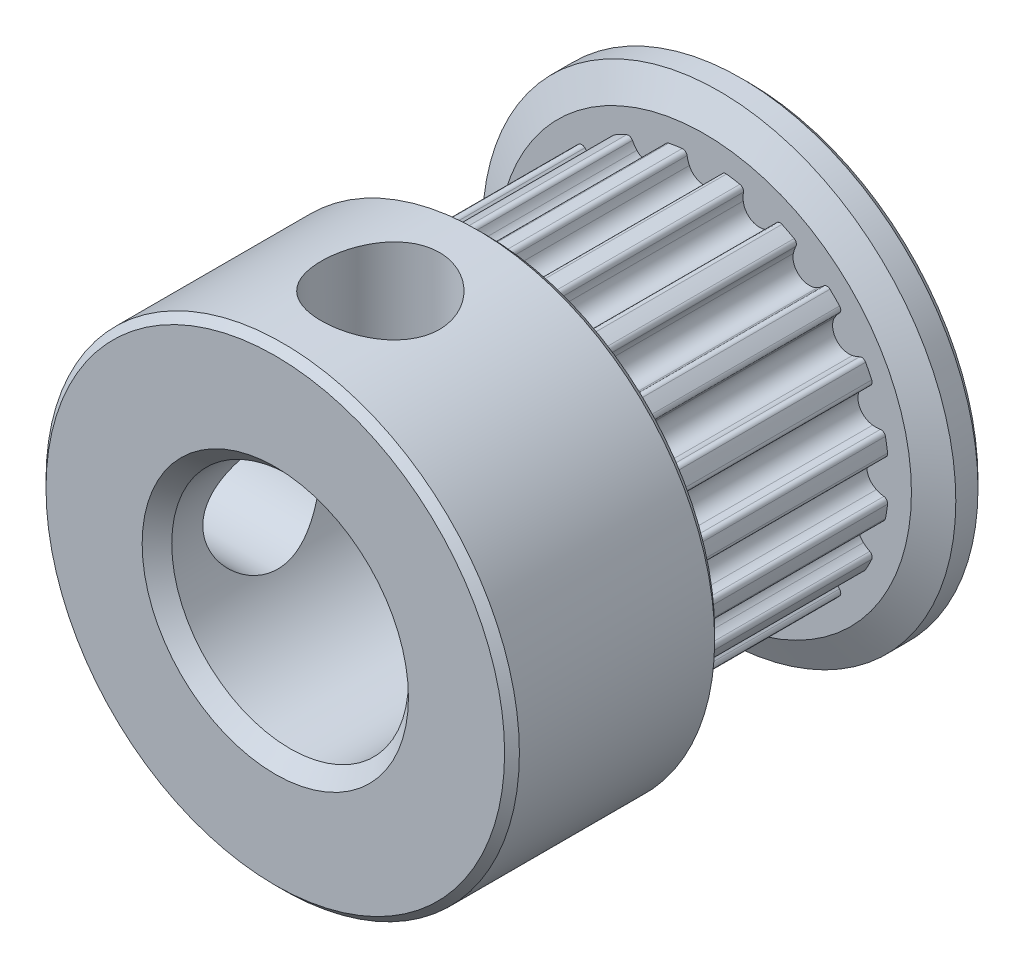
from build123d import *

# Parameters (mm, degrees)
SKETCH1_R            = 6.366
BASE_DEPTH           = 7.4
TOOTHCUT_DEPTH       = 12.653836793
TEETHCUTS_COUNT      = 20
SKETCH3_W            = 8
SKETCH3_H            = 7.1
SHAFTHOLE_DEPTH      = 19.391574158
SHAFTHOLE_DEPTH_BACK = 19.391574158
SKETCH4_R            = 4
SKETCH5_R            = 2
FIXINGHOLE_DEPTH     = 19.391574158
CIRPATTERN1_COUNT    = 2
CIRPATTERN1_ANGLE    = 90
CHAMFER1_SIZE        = 0.5
CHAMFER2_SIZE        = 0.25


with BuildPart() as part:
    # Sketch1 → Base (new body)
    with BuildSketch(Plane.XY):
        Circle(SKETCH1_R)
    extrude(amount=BASE_DEPTH)

    # Sketch2 → ToothCut (cut, through all)
    with BuildSketch(Plane.XY.offset(7.4)):
        with BuildLine():
            Line((-0.975994627, 6.162187557), (-0.995861804, 6.287623976))
            ThreePointArc((-0.995861804, 6.287623976), (0, 6.366), (0.995861804, 6.287623976))
            Line((0.995861804, 6.287623976), (0.975994627, 6.162187557))
            ThreePointArc((0.975994627, 6.162187557), (0.861900832, 6.179178583), (0.747512406, 6.19405733))
            ThreePointArc((0.747512406, 6.19405733), (0.639182458, 6.164868505), (0.581402261, 6.068697753))
            ThreePointArc((0.581402261, 6.068697753), (0.552274653, 5.940538449), (0.506591342, 5.817305906))
            ThreePointArc((0.506591342, 5.817305906), (0, 5.489), (-0.506591342, 5.817305906))
            ThreePointArc((-0.506591342, 5.817305906), (-0.552274653, 5.940538449), (-0.581402261, 6.068697753))
            ThreePointArc((-0.581402261, 6.068697753), (-0.639182458, 6.164868505), (-0.747512406, 6.19405733))
            ThreePointArc((-0.747512406, 6.19405733), (-0.861900832, 6.179178583), (-0.975994627, 6.162187557))
        make_face()
    toothcut = extrude(amount=-TOOTHCUT_DEPTH, mode=Mode.SUBTRACT)

    # TeethCuts: ToothCut ×20 about axis
    teethcuts_axis = Axis((0, 0, 0), (0, 0, 1))
    for i in range(1, TEETHCUTS_COUNT):
        add(toothcut.rotate(teethcuts_axis, i * 360 / TEETHCUTS_COUNT), mode=Mode.SUBTRACT)

    # Sketch3 → Body (revolve)
    with BuildSketch(Plane(origin=(0, 0, 0), x_dir=(1, 0, 0), z_dir=(0, 1, 0)), mode=Mode.PRIVATE) as body_sk:
        Polygon((0, 0), (0, 1.5), (-8, 1.5), (-8, 0.5), (-7, 0), align=None)
        with Locations((-4, -10.95)):
            Rectangle(SKETCH3_W, SKETCH3_H)
    revolve(body_sk.sketch.rotate(Axis((0, 0, 14.5), (0, 0, -1)), 180), axis=Axis((0, 0, 14.5), (0, 0, -1)))

    # Sketch4 → ShaftHole (cut, two sides: drawn at the far end of the back side and taken through both)
    with BuildSketch(Plane.XY.offset(-SHAFTHOLE_DEPTH_BACK)):
        with Locations(Location((0, 0, 0), (0, 0, 180))):
            Circle(SKETCH4_R)
    extrude(amount=SHAFTHOLE_DEPTH + SHAFTHOLE_DEPTH_BACK, mode=Mode.SUBTRACT)

    # Sketch5 → FixingHole (cut, through all)
    with BuildSketch(Plane(origin=(0, 0, 0), x_dir=(1, 0, 0), z_dir=(0, 1, 0))):
        with Locations(Location((0, -10.95, 0), (0, 0, 90))):
            Circle(SKETCH5_R)
    fixinghole = extrude(amount=FIXINGHOLE_DEPTH, mode=Mode.SUBTRACT)

    # CirPattern1: FixingHole ×2 about axis
    cirpattern1_axis = Axis((0, 0, 14.5), (0, 0, 1))
    for i in range(1, CIRPATTERN1_COUNT):
        add(fixinghole.rotate(cirpattern1_axis, i * CIRPATTERN1_ANGLE / (CIRPATTERN1_COUNT - 1)), mode=Mode.SUBTRACT)

    # Chamfer1
    chamfer1_edges = [part.edges().sort_by_distance(p)[0] for p in [
        (4, 0, -1.5),
        (4, 0, 14.5),
    ]]
    chamfer(chamfer1_edges, length=CHAMFER1_SIZE)

    # Chamfer2
    chamfer2_edges = [part.edges().sort_by_distance(p)[0] for p in [
        (-8, 0, -1.5),
        (-8, 0, 7.4),
        (-8, 0, 14.5),
    ]]
    chamfer(chamfer2_edges, length=CHAMFER2_SIZE)


solid = part.part
